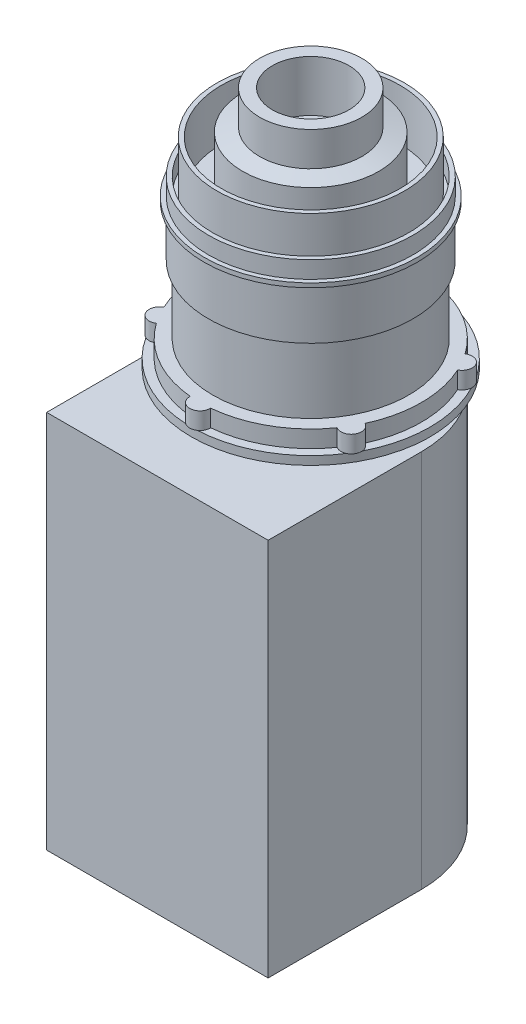
from build123d import *

# Parameters (mm, degrees)
BOSS_EXTRUDE1_DEPTH  = 139.7
SHELL1_T             = -1.5875
BOSS_EXTRUDE2_DEPTH  = 1.5875
SKETCH3_R            = 31.75
BOSS_EXTRUDE3_DEPTH  = 6.35
SKETCH4_R            = 44.45
BOSS_EXTRUDE4_DEPTH  = 3.175
BOSS_EXTRUDE5_DEPTH  = 6.35
SKETCH6_R            = 36.5125
BOSS_EXTRUDE6_DEPTH  = 25.4
SKETCH8_R            = 38.1
BOSS_EXTRUDE7_DEPTH  = 19.05
SKETCH9_R            = 39.6875
BOSS_EXTRUDE8_DEPTH  = 1.5875
SKETCH10_R           = 38.1
SKETCH10_R_2         = 36.5125
BOSS_EXTRUDE9_DEPTH  = 6.35
SKETCH12_R           = 34.925
SKETCH12_R_2         = 33.3375
BOSS_EXTRUDE10_DEPTH = 19.05
SKETCH15_R           = 14.2875
CUT_EXTRUDE1_DEPTH   = 19.05


with BuildPart() as part:
    # Sketch1 → Boss-Extrude1 (new body)
    with BuildSketch(Plane(origin=(0, 0, 0), x_dir=(1, 0, 0), z_dir=(0, 1, 0))):
        with BuildLine():
            Line((-41.275, 0), (41.275, 0))
            Line((41.275, 0), (41.275, 57.15))
            ThreePointArc((41.275, 57.15), (0, 98.425), (-41.275, 57.15))
            Line((-41.275, 57.15), (-41.275, 0))
        make_face()
    extrude(amount=BOSS_EXTRUDE1_DEPTH)

    # Shell1
    shell1_openings = [part.faces().sort_by_distance(p)[0] for p in [
        (0, 139.7, -45.257423889),
    ]]
    offset(amount=SHELL1_T, openings=shell1_openings, kind=Kind.INTERSECTION)

    # Sketch2 → Boss-Extrude2 (add)
    with BuildSketch(Plane(origin=(0, 139.7, 0), x_dir=(1, 0, 0), z_dir=(0, 1, 0))):
        with BuildLine():
            Line((41.275, 0), (41.275, 57.15))
            ThreePointArc((41.275, 57.15), (0, 98.425), (-41.275, 57.15))
            Line((-41.275, 57.15), (-41.275, 0))
            Line((-41.275, 0), (41.275, 0))
        make_face()
    extrude(amount=BOSS_EXTRUDE2_DEPTH)

    # Sketch3 → Boss-Extrude3 (add)
    with BuildSketch(Plane(origin=(0, 141.2875, 0), x_dir=(1, 0, 0), z_dir=(0, 1, 0))):
        with Locations(Location((0, 57.15, 0), (0, 0, 270))):
            Circle(SKETCH3_R)
    extrude(amount=BOSS_EXTRUDE3_DEPTH)

    # Sketch4 → Boss-Extrude4 (add)
    with BuildSketch(Plane(origin=(0, 147.6375, 0), x_dir=(1, 0, 0), z_dir=(0, 1, 0))):
        with Locations(Location((0, 57.15, 0), (0, 0, 270))):
            Circle(SKETCH4_R)
    extrude(amount=BOSS_EXTRUDE4_DEPTH)

    # Sketch5 → Boss-Extrude5 (add)
    with BuildSketch(Plane(origin=(0, 150.8125, 0), x_dir=(1, 0, 0), z_dir=(0, 1, 0))):
        with BuildLine():
            ThreePointArc((-3.805939848, 98.249153846), (-20.6375, 92.895198541), (-33.689941381, 80.995617517))
            ThreePointArc((-33.689941381, 80.995617517), (-39.04475533, 79.6925), (-37.495881229, 74.403536329))
            ThreePointArc((-37.495881229, 74.403536329), (-41.275, 57.15), (-37.495881229, 39.896463671))
            ThreePointArc((-37.495881229, 39.896463671), (-39.04475533, 34.6075), (-33.689941381, 33.304382483))
            ThreePointArc((-33.689941381, 33.304382483), (-20.6375, 21.404801459), (-3.805939848, 16.050846154))
            ThreePointArc((-3.805939848, 16.050846154), (0, 12.065), (3.805939848, 16.050846154))
            ThreePointArc((3.805939848, 16.050846154), (20.6375, 21.404801459), (33.689941381, 33.304382483))
            ThreePointArc((33.689941381, 33.304382483), (39.04475533, 34.6075), (37.495881229, 39.896463671))
            ThreePointArc((37.495881229, 39.896463671), (41.275, 57.15), (37.495881229, 74.403536329))
            ThreePointArc((37.495881229, 74.403536329), (39.04475533, 79.6925), (33.689941381, 80.995617517))
            ThreePointArc((33.689941381, 80.995617517), (20.6375, 92.895198541), (3.805939848, 98.249153846))
            ThreePointArc((3.805939848, 98.249153846), (0, 102.235), (-3.805939848, 98.249153846))
        make_face()
    extrude(amount=BOSS_EXTRUDE5_DEPTH)

    # Sketch6 → Boss-Extrude6 (add)
    with BuildSketch(Plane(origin=(0, 157.1625, 0), x_dir=(1, 0, 0), z_dir=(0, 1, 0))):
        with Locations(Location((0, 57.15, 0), (0, 0, 270))):
            Circle(SKETCH6_R)
    extrude(amount=BOSS_EXTRUDE6_DEPTH)

    # Sketch8 → Boss-Extrude7 (add)
    with BuildSketch(Plane(origin=(0, 182.5625, 0), x_dir=(1, 0, 0), z_dir=(0, 1, 0))):
        with Locations(Location((0, 57.15, 0), (0, 0, 90))):
            Circle(SKETCH8_R)
    extrude(amount=BOSS_EXTRUDE7_DEPTH)

    # Sketch9 → Boss-Extrude8 (add)
    with BuildSketch(Plane(origin=(0, 201.6125, 0), x_dir=(1, 0, 0), z_dir=(0, 1, 0))):
        with Locations(Location((0, 57.15, 0), (0, 0, 270))):
            Circle(SKETCH9_R)
    extrude(amount=BOSS_EXTRUDE8_DEPTH)

    # Sketch10 → Boss-Extrude9 (add)
    with BuildSketch(Plane(origin=(0, 203.2, 0), x_dir=(1, 0, 0), z_dir=(0, 1, 0))):
        with Locations(Location((0, 57.15, 0), (0, 0, 90))):
            Circle(SKETCH10_R)
        with Locations(Location((0, 57.15, 0), (0, 0, 270))):
            Circle(SKETCH10_R_2, mode=Mode.SUBTRACT)
    extrude(amount=BOSS_EXTRUDE9_DEPTH)

    # Sketch12 → Boss-Extrude10 (add)
    with BuildSketch(Plane(origin=(0, 203.2, 0), x_dir=(1, 0, 0), z_dir=(0, 1, 0))):
        with Locations(Location((0, 57.15, 0), (0, 0, 90))):
            Circle(SKETCH12_R)
        with Locations(Location((0, 57.15, 0), (0, 0, 90))):
            Circle(SKETCH12_R_2, mode=Mode.SUBTRACT)
    extrude(amount=BOSS_EXTRUDE10_DEPTH)

    # Sketch14 → Revolve1 (revolve)
    with BuildSketch(Plane(origin=(0, 0, 0), x_dir=(0, 0, -1), z_dir=(1, 0, 0)), mode=Mode.PRIVATE) as revolve1_sk:
        Polygon((57.15, 238.125), (76.2, 238.125), (76.2, 225.425), (82.55, 223.8375), (82.55, 203.2), (57.15, 203.2), align=None)
    revolve(revolve1_sk.sketch.rotate(Axis((0, 235.492882867, -57.15), (0, -1, 0)), 180), axis=Axis((0, 235.492882867, -57.15), (0, -1, 0)))

    # Sketch15 → Cut-Extrude1 (cut)
    with BuildSketch(Plane(origin=(0, 238.125, 0), x_dir=(1, 0, 0), z_dir=(0, 1, 0))):
        with Locations(Location((0, 57.15, 0), (0, 0, 270))):
            Circle(SKETCH15_R)
    extrude(amount=-CUT_EXTRUDE1_DEPTH, mode=Mode.SUBTRACT)


solid = part.part
